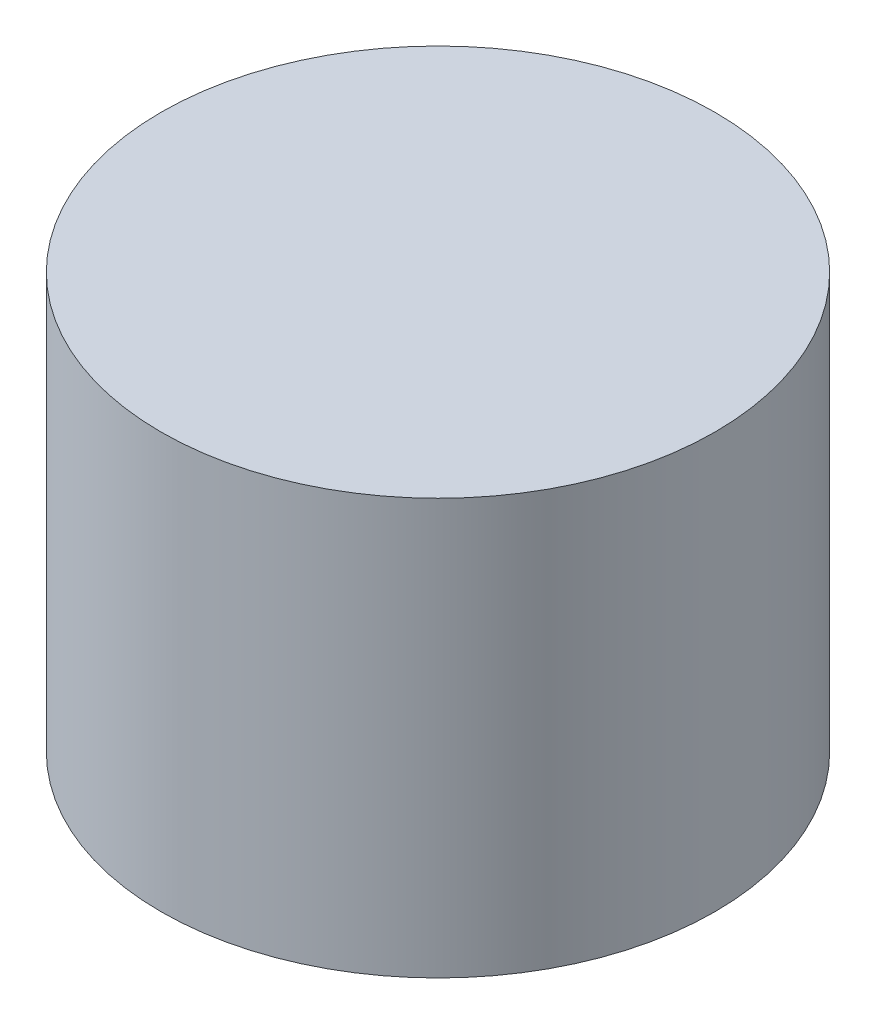
from build123d import *

# Parameters (mm, degrees)
ESBO_O1_R                = 4
RESSALTO_EXTRUS_O1_DEPTH = 6


with BuildPart() as part:
    # Esboço1 → Ressalto-extrusão1 (new body)
    with BuildSketch(Plane(origin=(0, 0, 0), x_dir=(1, 0, 0), z_dir=(0, 1, 0))):
        with Locations(Location((0, 0, 0), (0, 0, 270))):
            Circle(ESBO_O1_R)
    extrude(amount=RESSALTO_EXTRUS_O1_DEPTH)


solid = part.part
